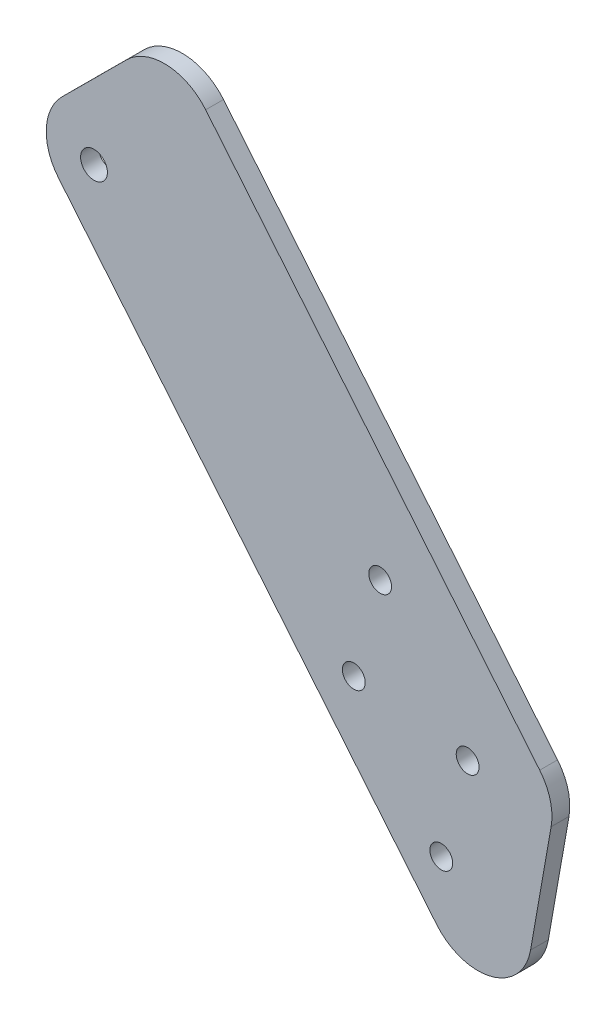
from build123d import *

# Parameters (mm, degrees)
SKETCH1_R           = 2.39
SKETCH1_R_2         = 2.032
BOSS_EXTRUDE1_DEPTH = 3.175
FILLET1_R           = 9.525


with BuildPart() as part:
    # Sketch1 → Boss-Extrude1 (new body)
    with BuildSketch(Plane.XY):
        Polygon((-13.549562782, 51.201238591), (55.395997605, -32.358681046), (47.399630983, -77.865858829), (-38.635835903, 26.208991527), align=None)
        with Locations((-26.780789006, 24.707545021)):
            Circle(SKETCH1_R, mode=Mode.SUBTRACT)
        with Locations((24.186660888, -13.868436177)):
            Circle(SKETCH1_R_2, mode=Mode.SUBTRACT)
        with Locations((19.493324021, -31.017809025)):
            Circle(SKETCH1_R_2, mode=Mode.SUBTRACT)
        with Locations((39.76308397, -33.93171218)):
            Circle(SKETCH1_R_2, mode=Mode.SUBTRACT)
        with Locations((35.069747103, -51.081085027)):
            Circle(SKETCH1_R_2, mode=Mode.SUBTRACT)
    extrude(amount=BOSS_EXTRUDE1_DEPTH)

    # Fillet1
    fillet1_edges = [part.edges().sort_by_distance(p)[0] for p in [
        (-13.549562782, 51.201238591, 1.5875),
        (55.395997605, -32.358681046, 1.5875),
        (47.399630983, -77.865858829, 1.5875),
        (-38.635835903, 26.208991527, 1.5875),
    ]]
    fillet(fillet1_edges, radius=FILLET1_R)


solid = part.part
